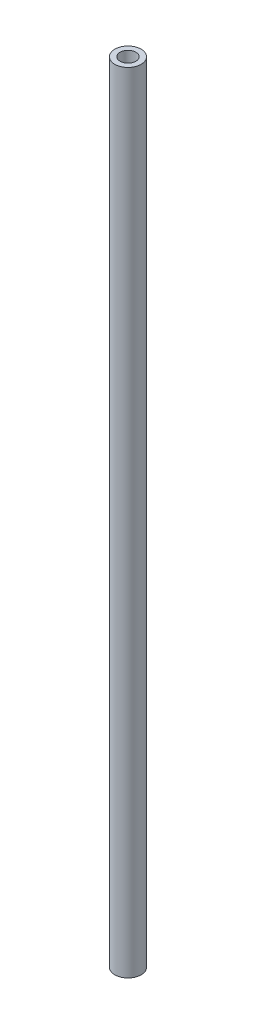
from build123d import *

# Parameters (mm, degrees)
SKETCH_2_R          = 5
EXTRUDE_1_DEPTH     = 150
SKETCH_4_R          = 3
CUT_EXTRUDE_1_DEPTH = 301.083321762


with BuildPart() as part:
    # 草图2 → 凸台-拉伸1 (new, symmetric)
    with BuildSketch(Plane(origin=(0, 0, 0), x_dir=(1, 0, 0), z_dir=(0, 1, 0))):
        with Locations(Location((0, 0, 0), (0, 0, 270))):
            Circle(SKETCH_2_R)
    extrude(amount=EXTRUDE_1_DEPTH, both=True)

    # 草图4 → 切除-拉伸1 (cut, through all)
    with BuildSketch(Plane(origin=(0, 150, 0), x_dir=(1, 0, 0), z_dir=(0, 1, 0))):
        with Locations(Location((0, 0, 0), (0, 0, 270))):
            Circle(SKETCH_4_R)
    extrude(amount=-CUT_EXTRUDE_1_DEPTH, mode=Mode.SUBTRACT)


solid = part.part
